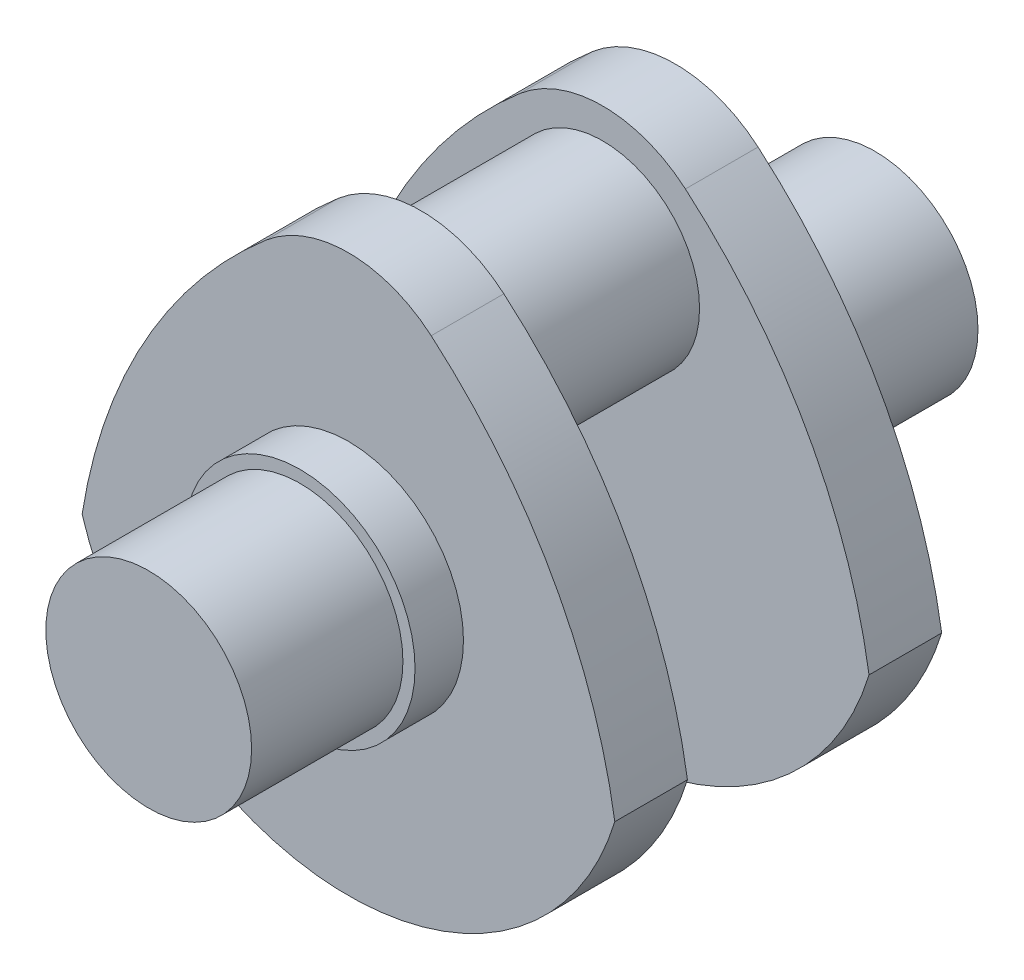
from build123d import *

# Parameters (mm, degrees)
SKETCH1_R           = 17
BOSS_EXTRUDE1_DEPTH = 25
SKETCH2_R           = 19
BOSS_EXTRUDE2_DEPTH = 8
BOSS_EXTRUDE3_DEPTH = 12
SKETCH4_R           = 16
BOSS_EXTRUDE4_DEPTH = 15


with BuildPart() as part:
    # Sketch1 → Boss-Extrude1 (new body)
    with BuildSketch(Plane.XY):
        Circle(SKETCH1_R)
    extrude(amount=BOSS_EXTRUDE1_DEPTH)

    # Sketch2 → Boss-Extrude2 (add)
    with BuildSketch(Plane.XY):
        Circle(SKETCH2_R)
    extrude(amount=-BOSS_EXTRUDE2_DEPTH)

    # Sketch3 → Boss-Extrude3 (add)
    with BuildSketch(Plane(origin=(0, 0, -8), x_dir=(-1, 0, 0), z_dir=(0, 0, -1))):
        with BuildLine():
            ThreePointArc((44, -13.416407865), (0, -46), (-44, -13.416407865))
            ThreePointArc((-44, -13.416407865), (-33.683444249, 16.469257624), (-13.668094758, 40.943123461))
            ThreePointArc((-13.668094758, 40.943123461), (0, 46), (13.668094758, 40.943123461))
            ThreePointArc((13.668094758, 40.943123461), (33.683444249, 16.469257624), (44, -13.416407865))
        make_face()
    extrude(amount=BOSS_EXTRUDE3_DEPTH)

    # Sketch4 → Boss-Extrude4 (add)
    with BuildSketch(Plane(origin=(0, 0, -20), x_dir=(-1, 0, 0), z_dir=(0, 0, -1))):
        with Locations(Location((0, 25, 0), (0, 0, 180))):
            Circle(SKETCH4_R)
    extrude(amount=BOSS_EXTRUDE4_DEPTH)

    # Mirror1: part across plane


with BuildPart() as part_1:
    add(part.part)
    add(part.part.mirror(Plane(origin=(0, 25, -35), x_dir=(1, 0, 0), z_dir=(0, 0, -1))))


solid = part_1.part
